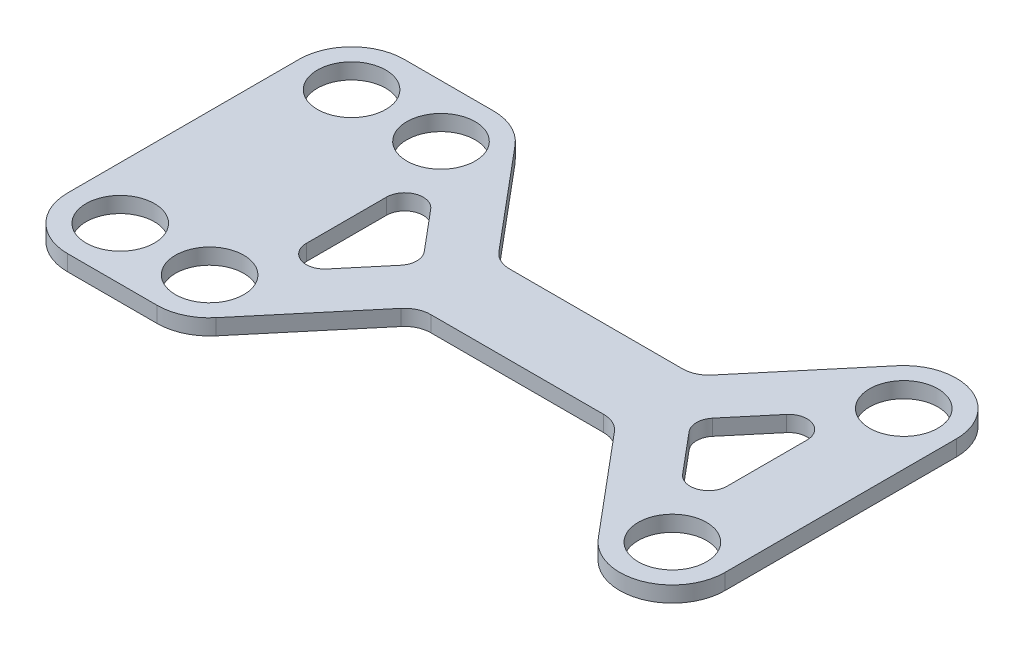
from build123d import *

# Parameters (mm, degrees)
BASE_DEPTH    = 3
SKETCH2_R     = 6.5
HOLES_DEPTH   = 120.406867474
CUTAWAY_DEPTH = 120.406867474


with BuildPart() as part:
    # Sketch1 → base (new body)
    with BuildSketch(Plane(origin=(0, 0, 0), x_dir=(1, 0, 0), z_dir=(0, 1, 0))):
        with BuildLine():
            Line((-10, -22), (-10, 22))
            ThreePointArc((-10, 22), (-7.071067812, 29.071067812), (0, 32))
            Line((0, 32), (17, 32))
            ThreePointArc((17, 32), (21.226182617, 31.06307787), (24.660444431, 28.427876097))
            Line((24.660444431, 28.427876097), (40.722333621, 9.286061952))
            ThreePointArc((40.722333621, 9.286061952), (42.439464527, 7.968461065), (44.552555836, 7.5))
            Line((44.552555836, 7.5), (77.447444164, 7.5))
            ThreePointArc((77.447444164, 7.5), (79.560535473, 7.968461065), (81.277666379, 9.286061952))
            Line((81.277666379, 9.286061952), (97.339555569, 28.427876097))
            ThreePointArc((97.339555569, 28.427876097), (108.420201433, 31.396926208), (115, 22))
            Line((115, 22), (115, -22))
            ThreePointArc((115, -22), (108.420201433, -31.396926208), (97.339555569, -28.427876097))
            Line((97.339555569, -28.427876097), (81.277666379, -9.286061952))
            ThreePointArc((81.277666379, -9.286061952), (79.560535473, -7.968461065), (77.447444164, -7.5))
            Line((77.447444164, -7.5), (44.552555836, -7.5))
            ThreePointArc((44.552555836, -7.5), (42.439464527, -7.968461065), (40.722333621, -9.286061952))
            Line((40.722333621, -9.286061952), (24.660444431, -28.427876097))
            ThreePointArc((24.660444431, -28.427876097), (21.226182617, -31.06307787), (17, -32))
            Line((17, -32), (0, -32))
            ThreePointArc((0, -32), (-7.071067812, -29.071067812), (-10, -22))
        make_face()
    extrude(amount=-BASE_DEPTH)

    # Sketch2 → holes (cut, through all)
    with BuildSketch(Plane(origin=(0, 0, 0), x_dir=(1, 0, 0), z_dir=(0, 1, 0))):
        with Locations(Location((0, 22, 0), (0, 0, 270))):
            Circle(SKETCH2_R)
        with Locations(Location((17, 22, 0), (0, 0, 270))):
            Circle(SKETCH2_R)
        with Locations(Location((105, 22, 0), (0, 0, 270))):
            Circle(SKETCH2_R)
        with Locations(Location((105, -22, 0), (0, 0, 270))):
            Circle(SKETCH2_R)
        with Locations(Location((17, -22, 0), (0, 0, 270))):
            Circle(SKETCH2_R)
        with Locations(Location((0, -22, 0), (0, 0, 270))):
            Circle(SKETCH2_R)
    extrude(amount=-HOLES_DEPTH, mode=Mode.SUBTRACT)

    # Sketch3 → cutaway (cut, through all)
    with BuildSketch(Plane(origin=(0, 0, 0), x_dir=(-1, 0, 0), z_dir=(0, 1, 0))):
        with BuildLine():
            Line((-21, -7.616814662), (-21, 7.616814662))
            ThreePointArc((-21, 7.616814662), (-23.302929498, 10.905738834), (-27.181155551, 9.866571295))
            Line((-27.181155551, 9.866571295), (-33.572421924, 2.249756634))
            ThreePointArc((-33.572421924, 2.249756634), (-34.391266373, 0), (-33.572421924, -2.249756634))
            Line((-33.572421924, -2.249756634), (-27.181155551, -9.866571295))
            ThreePointArc((-27.181155551, -9.866571295), (-23.302929498, -10.905738834), (-21, -7.616814662))
        make_face()
        with BuildLine():
            Line((-94.818844449, -9.866571295), (-88.427578076, -2.249756634))
            ThreePointArc((-88.427578076, -2.249756634), (-87.608733627, 0), (-88.427578076, 2.249756634))
            Line((-88.427578076, 2.249756634), (-94.818844449, 9.866571295))
            ThreePointArc((-94.818844449, 9.866571295), (-98.697070502, 10.905738834), (-101, 7.616814662))
            Line((-101, 7.616814662), (-101, -7.616814662))
            ThreePointArc((-101, -7.616814662), (-98.697070502, -10.905738834), (-94.818844449, -9.866571295))
        make_face()
    extrude(amount=-CUTAWAY_DEPTH, mode=Mode.SUBTRACT)


solid = part.part
